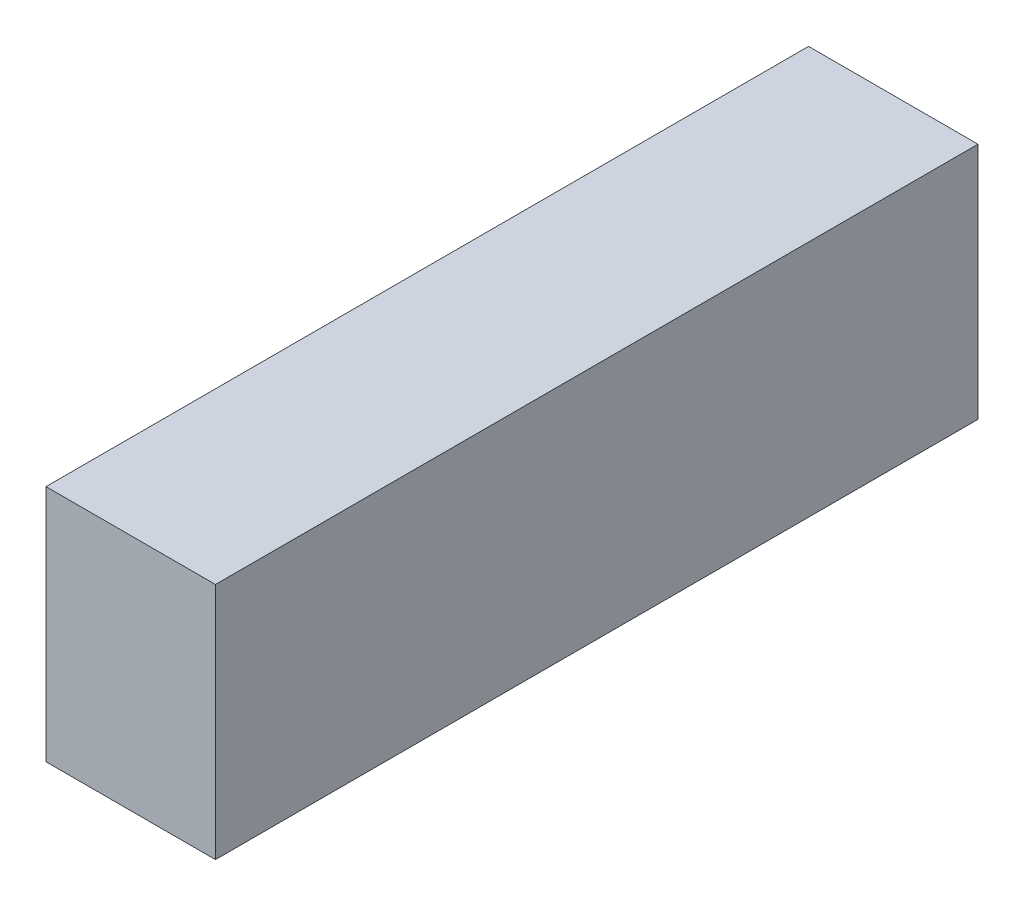
from build123d import *

# Parameters (mm, degrees)
BOSS_EXTRUDE1_DEPTH = 285.75


with BuildPart() as part:
    # Sketch1 → Boss-Extrude1 (new body)
    with BuildSketch(Plane(origin=(0, 0, 0), x_dir=(1, 0, 0), z_dir=(0, 1, 0))):
        Polygon((0, 0), (101.6, 0), (101.6, 914.4), (-101.6, 914.4), (-101.6, 0), align=None)
    extrude(amount=BOSS_EXTRUDE1_DEPTH)


solid = part.part
